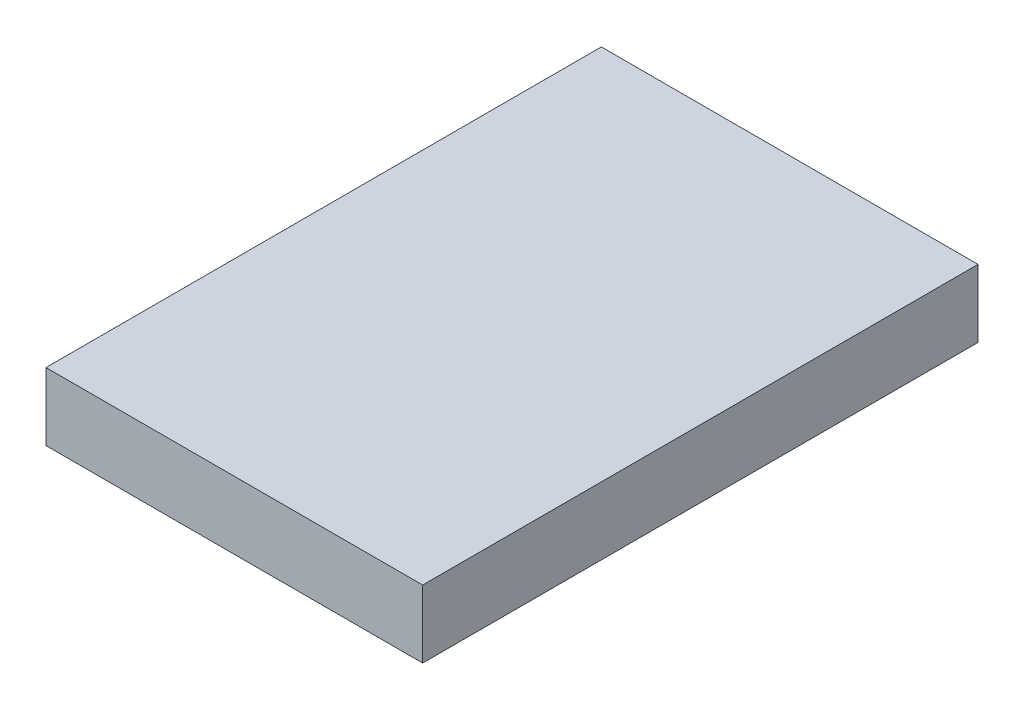
from build123d import *

# Parameters (mm, degrees)
SKETCH1_W           = 78
SKETCH1_H           = 115
BOSS_EXTRUDE1_DEPTH = 7


with BuildPart() as part:
    # Sketch1 → Boss-Extrude1 (new, symmetric)
    with BuildSketch(Plane(origin=(0, 0, 0), x_dir=(1, 0, 0), z_dir=(0, 1, 0))):
        Rectangle(SKETCH1_W, SKETCH1_H)
    extrude(amount=BOSS_EXTRUDE1_DEPTH, both=True)


solid = part.part
